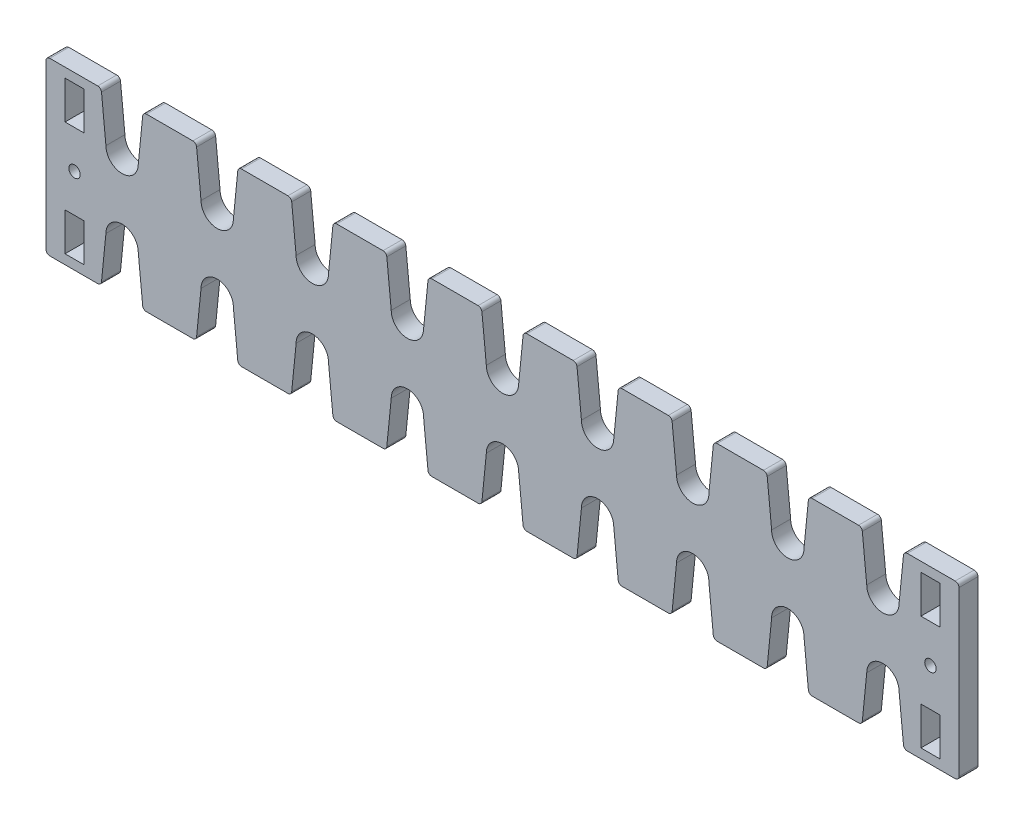
from build123d import *

# Parameters (mm, degrees)
SKETCH1_W           = 240
SKETCH1_H           = 45
SKETCH1_R           = 1.5
SKETCH1_W_2         = 5
SKETCH1_H_2         = 10
BOSS_EXTRUDE1_DEPTH = 5
CUT_EXTRUDE1_DEPTH  = 5
FILLET1_R           = 1


with BuildPart() as part:
    # Sketch1 → Boss-Extrude1 (new body)
    with BuildSketch(Plane.XY):
        with Locations((34.186746988, 0)):
            Rectangle(SKETCH1_W, SKETCH1_H)
        with Locations((-78.313253012, 0)):
            Circle(SKETCH1_R, mode=Mode.SUBTRACT)
        with Locations(Location((146.686746988, 0, 0), (0, 0, 180))):
            Circle(SKETCH1_R, mode=Mode.SUBTRACT)
        with Locations((-78.313253012, -15)):
            Rectangle(SKETCH1_W_2, SKETCH1_H_2, mode=Mode.SUBTRACT)
        with Locations((-78.313253012, 15)):
            Rectangle(SKETCH1_W_2, SKETCH1_H_2, mode=Mode.SUBTRACT)
        with Locations((146.686746988, -15)):
            Rectangle(SKETCH1_W_2, SKETCH1_H_2, mode=Mode.SUBTRACT)
        with Locations((146.686746988, 15)):
            Rectangle(SKETCH1_W_2, SKETCH1_H_2, mode=Mode.SUBTRACT)
    extrude(amount=BOSS_EXTRUDE1_DEPTH)

    # Sketch2 → Cut-Extrude1 (cut)
    with BuildSketch(Plane.XY.offset(5)):
        with BuildLine():
            Line((-71.313253012, 22.5), (-60.313253012, 22.5))
            Line((-60.313253012, 22.5), (-61.563253012, 10))
            ThreePointArc((-61.563253012, 10), (-65.813253012, 5.75), (-70.063253012, 10))
            Line((-70.063253012, 10), (-71.313253012, 22.5))
        make_face()
        with BuildLine():
            Line((-46.313253012, 22.5), (-35.313253012, 22.5))
            Line((-35.313253012, 22.5), (-36.563253012, 10))
            ThreePointArc((-36.563253012, 10), (-40.813253012, 5.75), (-45.063253012, 10))
            Line((-45.063253012, 10), (-46.313253012, 22.5))
        make_face()
        with BuildLine():
            Line((-21.313253012, 22.5), (-10.313253012, 22.5))
            Line((-10.313253012, 22.5), (-11.563253012, 10))
            ThreePointArc((-11.563253012, 10), (-15.813253012, 5.75), (-20.063253012, 10))
            Line((-20.063253012, 10), (-21.313253012, 22.5))
        make_face()
        with BuildLine():
            Line((3.686746988, 22.5), (14.686746988, 22.5))
            Line((14.686746988, 22.5), (13.436746988, 10))
            ThreePointArc((13.436746988, 10), (9.186746988, 5.75), (4.936746988, 10))
            Line((4.936746988, 10), (3.686746988, 22.5))
        make_face()
        with BuildLine():
            Line((28.686746988, 22.5), (39.686746988, 22.5))
            Line((39.686746988, 22.5), (38.436746988, 10))
            ThreePointArc((38.436746988, 10), (34.186746988, 5.75), (29.936746988, 10))
            Line((29.936746988, 10), (28.686746988, 22.5))
        make_face()
        with BuildLine():
            Line((53.686746988, 22.5), (64.686746988, 22.5))
            Line((64.686746988, 22.5), (63.436746988, 10))
            ThreePointArc((63.436746988, 10), (59.186746988, 5.75), (54.936746988, 10))
            Line((54.936746988, 10), (53.686746988, 22.5))
        make_face()
        with BuildLine():
            Line((78.686746988, 22.5), (89.686746988, 22.5))
            Line((89.686746988, 22.5), (88.436746988, 10))
            ThreePointArc((88.436746988, 10), (84.186746988, 5.75), (79.936746988, 10))
            Line((79.936746988, 10), (78.686746988, 22.5))
        make_face()
        with BuildLine():
            Line((103.686746988, 22.5), (114.686746988, 22.5))
            Line((114.686746988, 22.5), (113.436746988, 10))
            ThreePointArc((113.436746988, 10), (109.186746988, 5.75), (104.936746988, 10))
            Line((104.936746988, 10), (103.686746988, 22.5))
        make_face()
        with BuildLine():
            Line((128.686746988, 22.5), (139.686746988, 22.5))
            Line((139.686746988, 22.5), (138.436746988, 10))
            ThreePointArc((138.436746988, 10), (134.186746988, 5.75), (129.936746988, 10))
            Line((129.936746988, 10), (128.686746988, 22.5))
        make_face()
        with BuildLine():
            Line((139.686746988, -22.5), (138.436746988, -10))
            ThreePointArc((138.436746988, -10), (134.186746988, -5.75), (129.936746988, -10))
            Line((129.936746988, -10), (128.686746988, -22.5))
            Line((128.686746988, -22.5), (139.686746988, -22.5))
        make_face()
        with BuildLine():
            Line((114.686746988, -22.5), (113.436746988, -10))
            ThreePointArc((113.436746988, -10), (109.186746988, -5.75), (104.936746988, -10))
            Line((104.936746988, -10), (103.686746988, -22.5))
            Line((103.686746988, -22.5), (114.686746988, -22.5))
        make_face()
        with BuildLine():
            Line((89.686746988, -22.5), (88.436746988, -10))
            ThreePointArc((88.436746988, -10), (84.186746988, -5.75), (79.936746988, -10))
            Line((79.936746988, -10), (78.686746988, -22.5))
            Line((78.686746988, -22.5), (89.686746988, -22.5))
        make_face()
        with BuildLine():
            Line((64.686746988, -22.5), (63.436746988, -10))
            ThreePointArc((63.436746988, -10), (59.186746988, -5.75), (54.936746988, -10))
            Line((54.936746988, -10), (53.686746988, -22.5))
            Line((53.686746988, -22.5), (64.686746988, -22.5))
        make_face()
        with BuildLine():
            Line((39.686746988, -22.5), (38.436746988, -10))
            ThreePointArc((38.436746988, -10), (34.186746988, -5.75), (29.936746988, -10))
            Line((29.936746988, -10), (28.686746988, -22.5))
            Line((28.686746988, -22.5), (39.686746988, -22.5))
        make_face()
        with BuildLine():
            Line((14.686746988, -22.5), (13.436746988, -10))
            ThreePointArc((13.436746988, -10), (9.186746988, -5.75), (4.936746988, -10))
            Line((4.936746988, -10), (3.686746988, -22.5))
            Line((3.686746988, -22.5), (14.686746988, -22.5))
        make_face()
        with BuildLine():
            Line((-10.313253012, -22.5), (-11.563253012, -10))
            ThreePointArc((-11.563253012, -10), (-15.813253012, -5.75), (-20.063253012, -10))
            Line((-20.063253012, -10), (-21.313253012, -22.5))
            Line((-21.313253012, -22.5), (-10.313253012, -22.5))
        make_face()
        with BuildLine():
            Line((-35.313253012, -22.5), (-36.563253012, -10))
            ThreePointArc((-36.563253012, -10), (-40.813253012, -5.75), (-45.063253012, -10))
            Line((-45.063253012, -10), (-46.313253012, -22.5))
            Line((-46.313253012, -22.5), (-35.313253012, -22.5))
        make_face()
        with BuildLine():
            Line((-60.313253012, -22.5), (-61.563253012, -10))
            ThreePointArc((-61.563253012, -10), (-65.813253012, -5.75), (-70.063253012, -10))
            Line((-70.063253012, -10), (-71.313253012, -22.5))
            Line((-71.313253012, -22.5), (-60.313253012, -22.5))
        make_face()
    extrude(amount=-CUT_EXTRUDE1_DEPTH, mode=Mode.SUBTRACT)

    # Fillet1
    fillet1_edges = [part.edges().sort_by_distance(p)[0] for p in [
        (-60.313253012, -22.5, 2.5),
        (-71.313253012, -22.5, 2.5),
        (-35.313253012, -22.5, 2.5),
        (-46.313253012, -22.5, 2.5),
        (-10.313253012, -22.5, 2.5),
        (-21.313253012, -22.5, 2.5),
        (14.686746988, -22.5, 2.5),
        (3.686746988, -22.5, 2.5),
        (39.686746988, -22.5, 2.5),
        (28.686746988, -22.5, 2.5),
        (64.686746988, -22.5, 2.5),
        (53.686746988, -22.5, 2.5),
        (89.686746988, -22.5, 2.5),
        (78.686746988, -22.5, 2.5),
        (114.686746988, -22.5, 2.5),
        (103.686746988, -22.5, 2.5),
        (139.686746988, -22.5, 2.5),
        (128.686746988, -22.5, 2.5),
        (128.686746988, 22.5, 2.5),
        (139.686746988, 22.5, 2.5),
        (103.686746988, 22.5, 2.5),
        (114.686746988, 22.5, 2.5),
        (78.686746988, 22.5, 2.5),
        (89.686746988, 22.5, 2.5),
        (53.686746988, 22.5, 2.5),
        (64.686746988, 22.5, 2.5),
        (28.686746988, 22.5, 2.5),
        (39.686746988, 22.5, 2.5),
        (3.686746988, 22.5, 2.5),
        (14.686746988, 22.5, 2.5),
        (-21.313253012, 22.5, 2.5),
        (-10.313253012, 22.5, 2.5),
        (-46.313253012, 22.5, 2.5),
        (-35.313253012, 22.5, 2.5),
        (-71.313253012, 22.5, 2.5),
        (-60.313253012, 22.5, 2.5),
        (-85.813253012, 22.5, 2.5),
        (154.186746988, 22.5, 2.5),
        (154.186746988, -22.5, 2.5),
        (-85.813253012, -22.5, 2.5),
    ]]
    fillet(fillet1_edges, radius=FILLET1_R)


solid = part.part
